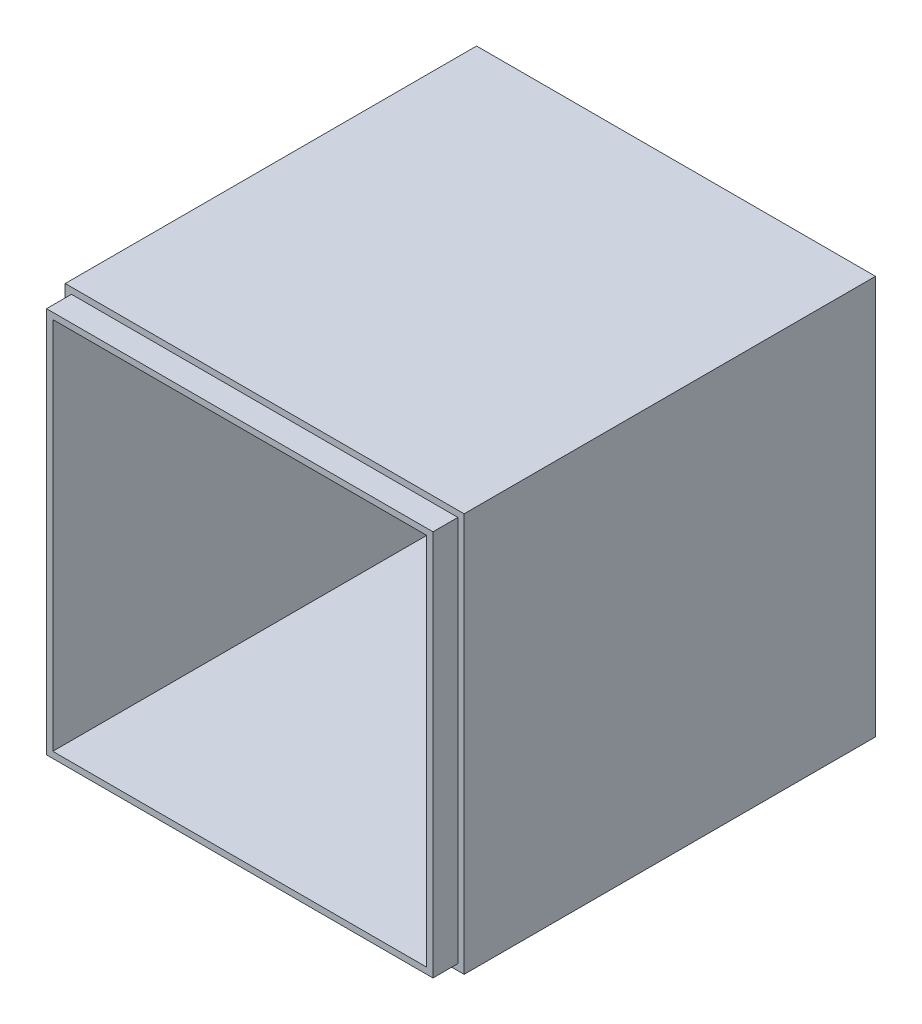
from build123d import *

# Parameters (mm, degrees)
SKETCH1_W           = 81.28
SKETCH1_H           = 81.28
BOSS_EXTRUDE1_DEPTH = 88.9
SHELL1_T            = -2.54
SKETCH2_W           = 91.781641856
SKETCH2_H           = 86.951733082
SKETCH2_W_2         = 78.74
SKETCH2_H_2         = 78.74
CUT_EXTRUDE1_DEPTH  = 5.08


with BuildPart() as part:
    # Sketch1 → Boss-Extrude1 (new body)
    with BuildSketch(Plane.XY):
        Rectangle(SKETCH1_W, SKETCH1_H)
    extrude(amount=BOSS_EXTRUDE1_DEPTH)

    # Shell1
    shell1_openings = [part.faces().sort_by_distance(p)[0] for p in [
        (0, 0, 88.9),
    ]]
    offset(amount=SHELL1_T, openings=shell1_openings, kind=Kind.INTERSECTION)

    # Sketch2 → Cut-Extrude1 (cut)
    with BuildSketch(Plane.XY.offset(88.9)):
        Rectangle(SKETCH2_W, SKETCH2_H)
        Rectangle(SKETCH2_W_2, SKETCH2_H_2, mode=Mode.SUBTRACT)
    extrude(amount=-CUT_EXTRUDE1_DEPTH, mode=Mode.SUBTRACT)


solid = part.part
